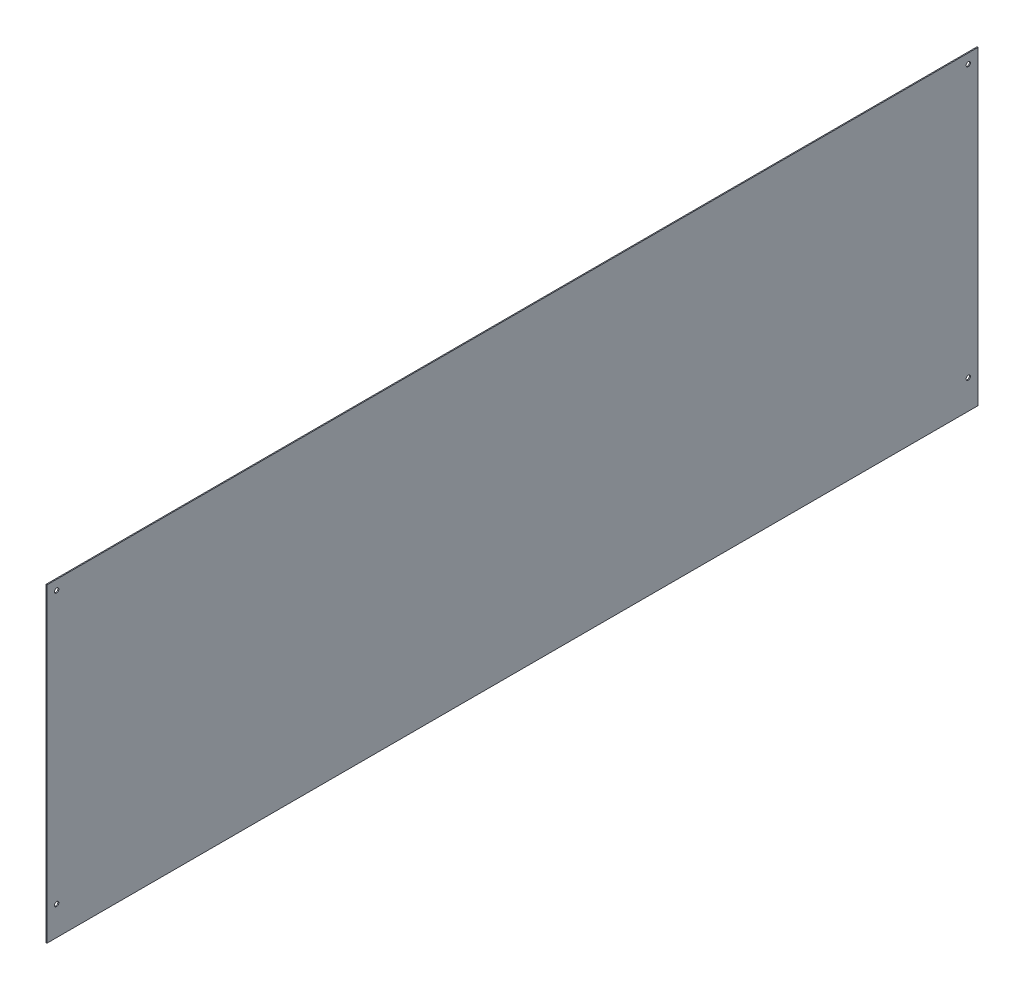
from build123d import *

# Parameters (mm, degrees)
SKETCH1_W   = 1920
SKETCH1_H   = 640
SKETCH1_R   = 4.5
THICKEN1_T1 = 2


with BuildPart() as body_1:
    # Sketch1 → Surface-Plane1: a flat surface bounded by the sketch
    with BuildSketch(Plane(origin=(0, 0, 0), x_dir=(0, 0, -1), z_dir=(1, 0, 0)), mode=Mode.PRIVATE) as surface_plane1_1_region:
        Rectangle(SKETCH1_W, SKETCH1_H)
        with Locations((-940, 300)):
            Circle(SKETCH1_R, mode=Mode.SUBTRACT)
        with Locations((940, 300)):
            Circle(SKETCH1_R, mode=Mode.SUBTRACT)
        with Locations((940, -260)):
            Circle(SKETCH1_R, mode=Mode.SUBTRACT)
        with Locations((-940, -260)):
            Circle(SKETCH1_R, mode=Mode.SUBTRACT)
    surface_plane1_1 = surface_plane1_1_region.sketch.faces()[0]
    add(Solid.thicken(surface_plane1_1, THICKEN1_T1))


solid = body_1.part
